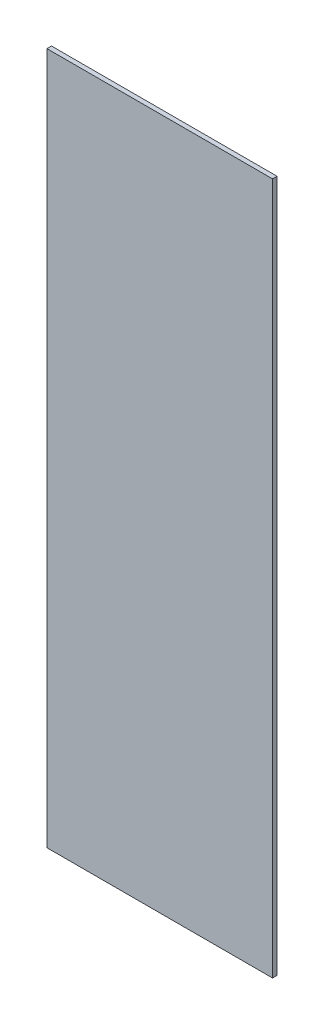
from build123d import *

# Parameters (mm, degrees)
SKETCH1_W           = 78.887500086
SKETCH1_H           = 242.060000004
BOSS_EXTRUDE1_DEPTH = 1.5875


with BuildPart() as part:
    # Sketch1 → Boss-Extrude1 (new body)
    with BuildSketch(Plane.XY):
        with Locations((36.770111012, -0.9959025)):
            Rectangle(SKETCH1_W, SKETCH1_H)
    extrude(amount=BOSS_EXTRUDE1_DEPTH)


solid = part.part
